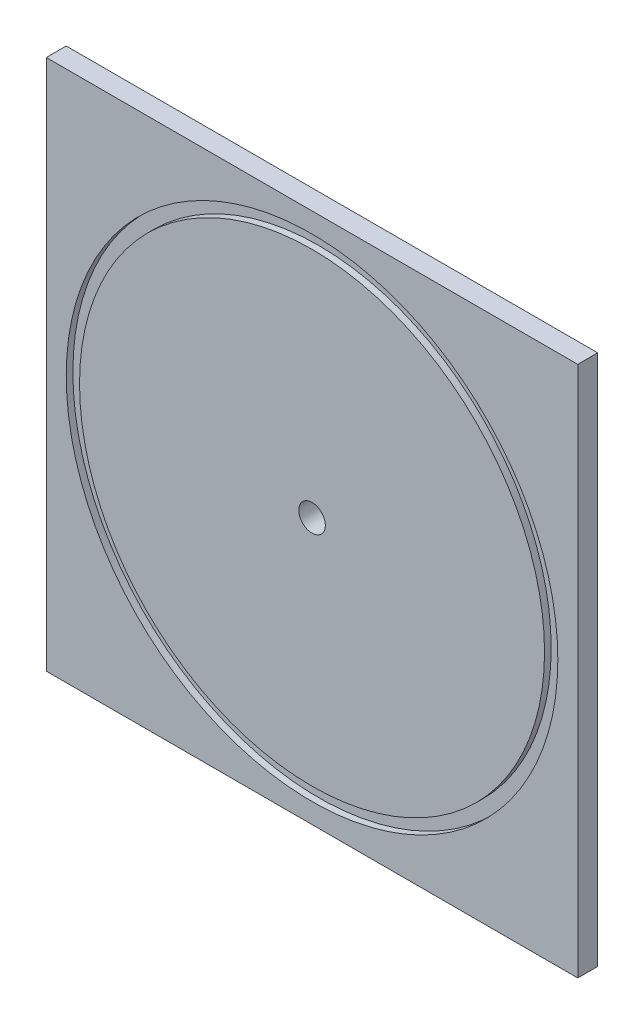
from build123d import *

# Parameters (mm, degrees)
SKETCH2_W           = 101.6
SKETCH2_H           = 101.6
SLEEVE_DEPTH        = 3.81
SKETCH3_R           = 2.54
HOLE_DEPTH          = 72.943005914
SKETCH4_R           = 46.99
SKETCH4_R_2         = 44.45
VINYL_OUTLINE_DEPTH = 1.27


with BuildPart() as part:
    # Sketch2 → Sleeve (new body)
    with BuildSketch(Plane.XY):
        Rectangle(SKETCH2_W, SKETCH2_H)
    extrude(amount=SLEEVE_DEPTH)

    # Sketch3 → Hole (cut, through all)
    with BuildSketch(Plane.XY.offset(3.81)):
        Circle(SKETCH3_R)
    extrude(amount=-HOLE_DEPTH, mode=Mode.SUBTRACT)

    # Sketch4 → Vinyl Outline (cut)
    with BuildSketch(Plane.XY.offset(3.81)):
        Circle(SKETCH4_R)
        Circle(SKETCH4_R_2, mode=Mode.SUBTRACT)
    extrude(amount=-VINYL_OUTLINE_DEPTH, mode=Mode.SUBTRACT)


solid = part.part
